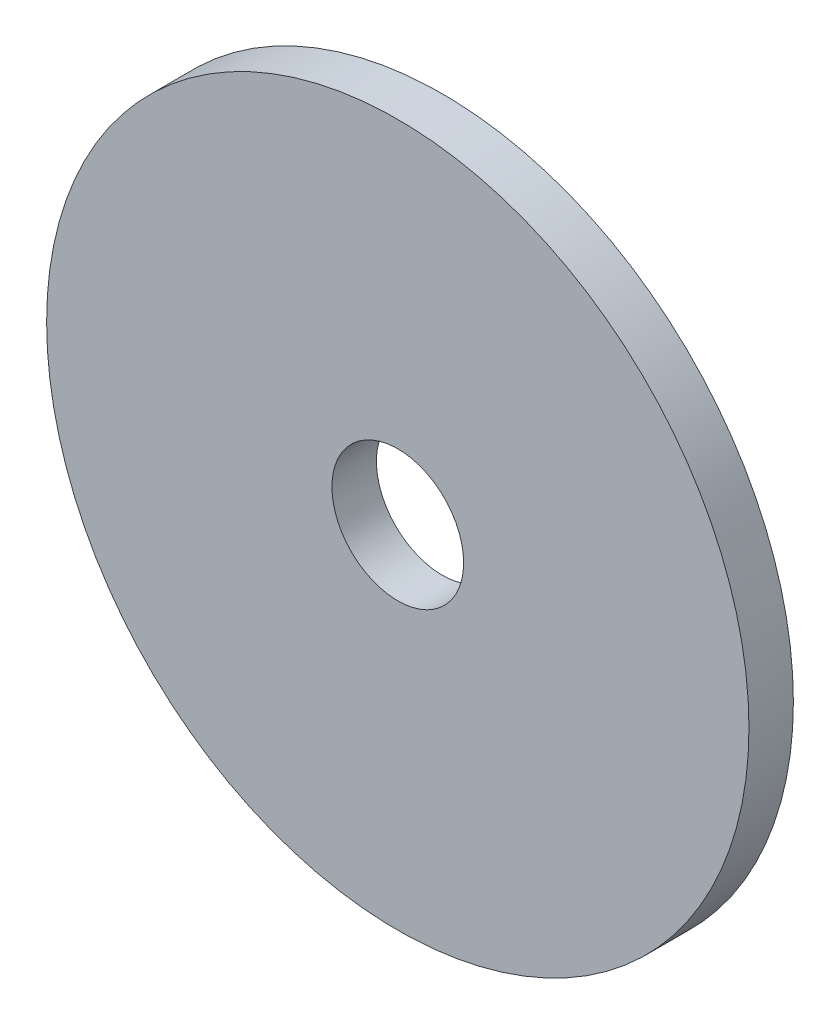
from build123d import *

# Parameters (mm, degrees)
CROQUIS1_R              = 2
CROQUIS1_R_2            = 0.375
SALIENTE_EXTRUIR1_DEPTH = 0.253


with BuildPart() as part:
    # Croquis1 → Saliente-Extruir1 (new body)
    with BuildSketch(Plane.XY):
        Circle(CROQUIS1_R)
        Circle(CROQUIS1_R_2, mode=Mode.SUBTRACT)
    extrude(amount=SALIENTE_EXTRUIR1_DEPTH)


solid = part.part
